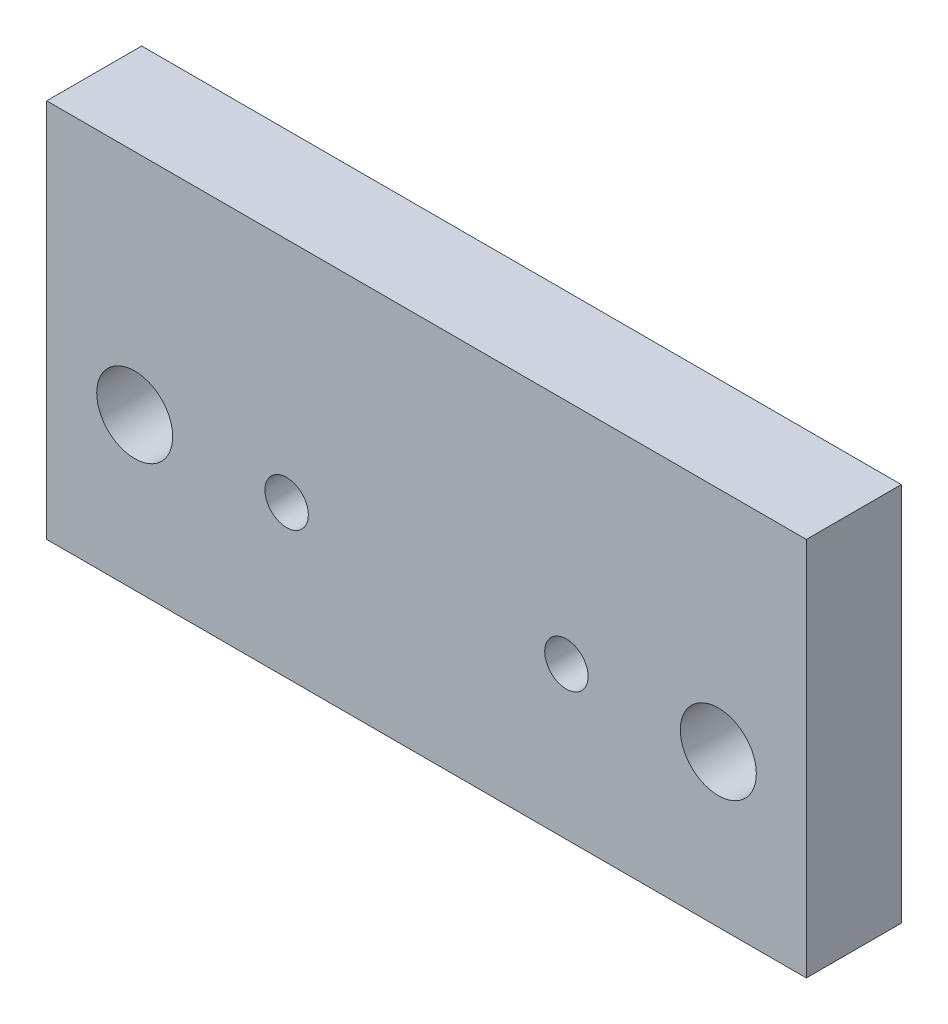
from build123d import *

# Parameters (mm, degrees)
SKETCH1_W           = 40
SKETCH1_H           = 20
BOSS_EXTRUDE1_DEPTH = 5
SKETCH2_R           = 1.143
SKETCH2_R_2         = 2
CUT_EXTRUDE1_DEPTH  = 10


with BuildPart() as part:
    # Sketch1 → Boss-Extrude1 (new body)
    with BuildSketch(Plane.XY):
        Rectangle(SKETCH1_W, SKETCH1_H)
    extrude(amount=BOSS_EXTRUDE1_DEPTH)

    # Sketch2 → Cut-Extrude1 (cut)
    with BuildSketch(Plane(origin=(0, 0, 0), x_dir=(-1, 0, 0), z_dir=(0, 0, -1))):
        with Locations((7.366, -2)):
            Circle(SKETCH2_R)
        with Locations((-7.366, -2)):
            Circle(SKETCH2_R)
        with Locations((-15.366, -2)):
            Circle(SKETCH2_R_2)
        with Locations((15.366, -2)):
            Circle(SKETCH2_R_2)
    extrude(amount=-CUT_EXTRUDE1_DEPTH, mode=Mode.SUBTRACT)


solid = part.part
